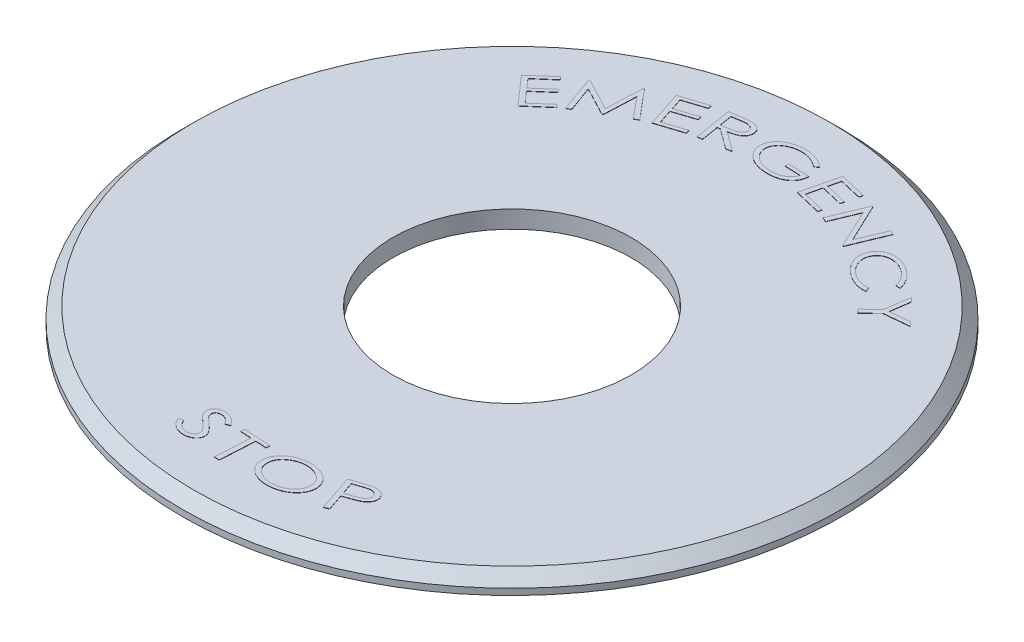
from build123d import *

# Parameters (mm, degrees)
SKETCH1_R         = 29.845
SKETCH1_R_2       = 10.795
EXTRUDE1_DEPTH    = 1.5875
CHAMFER1_SIZE     = 1.016
EXTRUDE3_DEPTH    = 0.508
CIRPATTERN1_COUNT = 8
SKETCH4_R         = 13.208
SKETCH4_R_2       = 11.557
EXTRUDE4_DEPTH    = 0.508
EXTRUDE5_DEPTH    = 0.0254


with BuildPart() as part:
    # Sketch1 → Extrude1 (new body)
    with BuildSketch(Plane(origin=(0, 0, 0), x_dir=(1, 0, 0), z_dir=(0, 1, 0))):
        Circle(SKETCH1_R)
        Circle(SKETCH1_R_2, mode=Mode.SUBTRACT)
    extrude(amount=EXTRUDE1_DEPTH)

    # Chamfer1
    chamfer1_edges = [part.edges().sort_by_distance(p)[0] for p in [
        (-29.845, 1.5875, 0),
    ]]
    chamfer(chamfer1_edges, length=CHAMFER1_SIZE)

    # Sketch3 → Extrude3 (cut)
    with BuildSketch(Plane.XZ):
        with BuildLine():
            ThreePointArc((20.426684812, 20.701966974), (11.156991617, 26.857818732), (0.254, 29.081890809))
            Line((0.254, 29.081890809), (0.254, 13.967690718))
            ThreePointArc((0.254, 13.967690718), (5.441836265, 12.866519267), (9.845405272, 9.911049139))
            Line((9.845405272, 9.911049139), (20.426684812, 20.701966974))
        make_face()
    extrude3 = extrude(amount=-EXTRUDE3_DEPTH, mode=Mode.SUBTRACT)

    # CirPattern1: Extrude3 ×8 about axis
    cirpattern1_axis = Axis((0, 24.887283079, 0), (0, -1, 0))
    for i in range(1, CIRPATTERN1_COUNT):
        add(extrude3.rotate(cirpattern1_axis, i * 360 / CIRPATTERN1_COUNT), mode=Mode.SUBTRACT)

    # Sketch4 → Extrude4 (cut)
    with BuildSketch(Plane.XZ):
        Circle(SKETCH4_R)
        Circle(SKETCH4_R_2, mode=Mode.SUBTRACT)
    extrude(amount=-EXTRUDE4_DEPTH, mode=Mode.SUBTRACT)

    # Sketch5 → Extrude5 (add)
    # profile 1 of 13: a face of its own
    with BuildSketch(Plane(origin=(0, 1.5875, 0), x_dir=(1, 0, 0), z_dir=(0, 1, 0))):
        Polygon((17.415382675, 18.775384539), (17.7626483, 18.409515399), (17.512534368, 16.633224166), (19.286758543, 16.803411883), (19.634713187, 16.436853723), (17.391956026, 16.216367612), (16.210977293, 15.09602256), (15.914699082, 15.408148211), (17.095677814, 16.528493263), align=None)
    # profile 2 of 13: a face of its own
    with BuildSketch(Plane(origin=(0, 1.5875, 0), x_dir=(1, 0, 0), z_dir=(0, 1, 0))):
        with BuildLine():
            Line((16.165389077, 18.955341756), (15.764379962, 18.991859769))
            add(Edge.make_bspline(
                [(15.764379962, 18.991859769), (15.758784608, 19.02523443), (15.74760629, 19.091909851), (15.724069257, 19.190687033), (15.694230038, 19.28757252), (15.659614723, 19.383276421), (15.61989966, 19.477498145), (15.573899237, 19.570187989), (15.523294071, 19.661750633), (15.466312621, 19.751262788), (15.405403506, 19.839428903), (15.338891723, 19.924990889), (15.267821752, 20.008411438), (15.192192321, 20.089817717), (15.111186033, 20.168102084), (15.026551168, 20.245150659), (14.936124459, 20.318545382), (14.873405558, 20.365510973), (14.841783391, 20.389190498)],
                knots=[0, 0, 0, 0, 0.944440671, 1.886790037, 2.831861546, 3.772879647, 4.726674445, 5.684318371, 6.66009623, 7.645493885, 8.644993475, 9.650376926, 10.669121946, 11.703363142, 12.750656649, 13.812855878, 14.897266434, 16, 16, 16, 16], degree=3))
            add(Edge.make_bspline(
                [(14.841783391, 20.389190498), (14.806436211, 20.414142045), (14.736196151, 20.463724451), (14.627147622, 20.530919306), (14.516829407, 20.592366426), (14.405094997, 20.647916687), (14.291237049, 20.695926376), (14.176039294, 20.738013509), (14.059359216, 20.774291962), (13.94136764, 20.802541929), (13.824237549, 20.825778962), (13.708640059, 20.840528478), (13.595765392, 20.850043403), (13.485243586, 20.851459444), (13.377529232, 20.845151454), (13.272540403, 20.832159938), (13.170107929, 20.812037098), (13.070551218, 20.785422071), (12.974589082, 20.751829622), (12.883415726, 20.710692686), (12.796264224, 20.664354668), (12.714774929, 20.609806991), (12.637099332, 20.550058188), (12.564704365, 20.482551154), (12.496133489, 20.40931859), (12.455481047, 20.355578881), (12.435039685, 20.328556817)],
                knots=[0, 0, 0, 0, 1.164710486, 2.31445152, 3.446646924, 4.563933522, 5.672302783, 6.771751945, 7.865184805, 8.960068085, 10.037026936, 11.078661862, 12.096003736, 13.08550605, 14.051799545, 14.999068238, 15.931690709, 16.860224378, 17.771632321, 18.665736224, 19.551136871, 20.425848185, 21.302851695, 22.186825914, 23.088277427, 24, 24, 24, 24], degree=3))
            add(Edge.make_bspline(
                [(12.435039685, 20.328556817), (12.406328165, 20.286520556), (12.349654432, 20.203545084), (12.285502378, 20.068543185), (12.236834456, 19.929645861), (12.207241237, 19.785272083), (12.195833346, 19.636036871), (12.201473374, 19.48208823), (12.225445891, 19.323441294), (12.267167231, 19.161962033), (12.32366417, 19.000287318), (12.396613803, 18.842407973), (12.484472098, 18.689933607), (12.586871401, 18.542508244), (12.704802369, 18.40087282), (12.837502093, 18.264609192), (12.984456959, 18.132799095), (13.091500823, 18.052399865), (13.146107393, 18.011385593)],
                knots=[0, 0, 0, 0, 0.904865988, 1.786117009, 2.650993001, 3.51926302, 4.400912175, 5.309022743, 6.255421567, 7.250865147, 8.273543539, 9.299680296, 10.341662699, 11.401951927, 12.490640397, 13.618110281, 14.784920286, 16, 16, 16, 16], degree=3))
            add(Edge.make_bspline(
                [(13.146107393, 18.011385593), (13.207875787, 17.968480884), (13.329460477, 17.884027406), (13.520973708, 17.77831944), (13.714582925, 17.691146156), (13.911266634, 17.624860087), (14.110494858, 17.577315698), (14.312470068, 17.5509433), (14.517230874, 17.542073769), (14.653724945, 17.553124969), (14.722583087, 17.558700046)],
                knots=[0, 0, 0, 0, 1.074401047, 2.11484725, 3.1214941, 4.105658546, 5.077125838, 6.044240132, 7.013363793, 8, 8, 8, 8], degree=3))
            Line((14.722583087, 17.558700046), (14.883124537, 17.190763848))
            add(Edge.make_bspline(
                [(14.883124537, 17.190763848), (14.844826536, 17.185355668), (14.768234589, 17.174539881), (14.651692546, 17.16881541), (14.534173458, 17.166467648), (14.415062764, 17.173547773), (14.294412637, 17.185260727), (14.172761294, 17.206097358), (14.049280604, 17.23112192), (13.925146133, 17.264325423), (13.800410772, 17.304449505), (13.675609271, 17.350728234), (13.550813079, 17.402935735), (13.426655495, 17.462296316), (13.303311335, 17.528877711), (13.179808597, 17.600999512), (13.057080135, 17.680478066), (12.976644675, 17.737334227), (12.935956568, 17.766094795)],
                knots=[0, 0, 0, 0, 0.890980028, 1.781865701, 2.687119789, 3.598851076, 4.530104735, 5.479550611, 6.441938444, 7.433184799, 8.439302083, 9.460965448, 10.500128348, 11.556129503, 12.631340021, 13.729870093, 14.851659602, 16, 16, 16, 16], degree=3))
            add(Edge.make_bspline(
                [(12.935956568, 17.766094795), (12.897836502, 17.794283925), (12.822680647, 17.84986038), (12.715254276, 17.937174394), (12.612845788, 18.024985616), (12.517460525, 18.115593009), (12.426622239, 18.206543899), (12.341767487, 18.299450063), (12.263486768, 18.39446719), (12.190667526, 18.490826748), (12.1233747, 18.588191156), (12.061530466, 18.687040914), (12.006381123, 18.787949803), (11.957084411, 18.890437508), (11.912325195, 18.994053498), (11.874886641, 19.099659165), (11.841845306, 19.2063804), (11.82526736, 19.278832488), (11.816989554, 19.315009725)],
                knots=[0, 0, 0, 0, 1.163838423, 2.294572891, 3.397925012, 4.474940909, 5.523581547, 6.55339072, 7.562711112, 8.544987084, 9.517863381, 10.467620291, 11.406366228, 12.339489813, 13.259072859, 14.175850973, 15.089154324, 16, 16, 16, 16], degree=3))
            add(Edge.make_bspline(
                [(11.816989554, 19.315009725), (11.805980971, 19.375250146), (11.784412319, 19.493276649), (11.771835369, 19.670179631), (11.778342262, 19.842154539), (11.801058102, 20.009402898), (11.843855529, 20.171558012), (11.904443621, 20.328322973), (11.98106389, 20.481483631), (12.046402961, 20.576173224), (12.07950583, 20.62414601)],
                knots=[0, 0, 0, 0, 1.06650466, 2.089557373, 3.082710036, 4.060709098, 5.024604639, 5.997497307, 6.985467896, 8, 8, 8, 8], degree=3))
            add(Edge.make_bspline(
                [(12.07950583, 20.62414601), (12.098047163, 20.648724563), (12.134926889, 20.697612652), (12.194963355, 20.766244992), (12.257951949, 20.830693494), (12.323737207, 20.8906064), (12.393266379, 20.945302516), (12.465751006, 20.99566534), (12.541498155, 21.042038176), (12.620667783, 21.082990632), (12.702559429, 21.120184332), (12.788010989, 21.151318778), (12.876381621, 21.179268064), (12.968009429, 21.201848287), (13.062827286, 21.219619387), (13.160734062, 21.233563856), (13.261939, 21.242389073), (13.400773491, 21.2477335), (13.576761951, 21.243422674), (13.787903173, 21.21818225), (13.998795817, 21.174803223), (14.208271112, 21.110678989), (14.41752847, 21.028552294), (14.624873094, 20.925456003), (14.832647115, 20.805192758), (14.966011769, 20.711756161), (15.034019719, 20.664109118)],
                knots=[0, 0, 0, 0, 0.674943053, 1.34249872, 1.997802155, 2.650293325, 3.292123821, 3.93618328, 4.584853662, 5.238121838, 5.889601514, 6.55569272, 7.231086586, 7.921228864, 8.623521217, 9.345738311, 10.08896785, 10.850053427, 12.391696234, 13.94344097, 15.507015875, 17.106634685, 18.741425359, 20.430698502, 22.179870954, 24, 24, 24, 24], degree=3))
            add(Edge.make_bspline(
                [(15.034019719, 20.664109118), (15.074687465, 20.633882092), (15.154916093, 20.574250736), (15.26954273, 20.480371688), (15.377215955, 20.383419607), (15.479305814, 20.284597584), (15.574570626, 20.18253668), (15.662660206, 20.077555706), (15.745062313, 19.97065216), (15.820557214, 19.861314278), (15.889751359, 19.75049365), (15.950885155, 19.638311723), (16.004706845, 19.525744532), (16.05190489, 19.412938816), (16.09210977, 19.299693111), (16.123548569, 19.185347262), (16.148898781, 19.070854948), (16.159901478, 18.993781945), (16.165389077, 18.955341756)],
                knots=[0, 0, 0, 0, 1.15394363, 2.276480149, 3.372924232, 4.453076118, 5.511580299, 6.551042735, 7.573224936, 8.584575423, 9.575978905, 10.547434217, 11.492664821, 12.416521926, 13.331390838, 14.227402549, 15.115916379, 16, 16, 16, 16], degree=3))
        make_face()
    # profile 3 of 13: a face of its own
    with BuildSketch(Plane(origin=(0, 1.5875, 0), x_dir=(1, 0, 0), z_dir=(0, 1, 0))):
        Polygon((7.167342293, 20.994868507), (8.479923673, 24.162289297), (8.567429098, 24.126460304), (10.23761139, 20.593170374), (11.242201234, 23.017828577), (11.638387215, 22.853842032), (10.325805834, 19.686421242), (10.235544333, 19.724317292), (8.575697327, 23.216955096), (7.583509827, 20.822613733), align=None)
    # profile 4 of 13: a face of its own
    with BuildSketch(Plane(origin=(0, 1.5875, 0), x_dir=(1, 0, 0), z_dir=(0, 1, 0))):
        Polygon((4.806404428, 25.150815293), (7.238641841, 24.575484347), (7.161471702, 24.247511257), (5.152981034, 24.722245415), (4.907001216, 23.682515597), (6.898266407, 23.211915553), (6.821096268, 22.886009521), (4.829831077, 23.356609564), (4.521839541, 22.052296413), (6.513104732, 21.581696369), (6.435245574, 21.253723279), (4.020233638, 21.824920111), align=None)
    # profile 5 of 13: a face of its own
    with BuildSketch(Plane(origin=(0, 1.5875, 0), x_dir=(1, 0, 0), z_dir=(0, 1, 0))):
        with BuildLine():
            Line((3.0812397, 24.81833546), (2.733285056, 24.580623871))
            add(Edge.make_bspline(
                [(2.733285056, 24.580623871), (2.673436977, 24.628091962), (2.554157143, 24.722697939), (2.361506067, 24.845208713), (2.159524749, 24.950730194), (1.950559352, 25.039940594), (1.737890605, 25.1109867), (1.525702451, 25.16531619), (1.3152429, 25.201433278), (1.175078757, 25.210654261), (1.105821948, 25.21521046)],
                knots=[0, 0, 0, 0, 1.031253619, 2.055333505, 3.078026249, 4.106593243, 5.120984967, 6.103651682, 7.062991215, 8, 8, 8, 8], degree=3))
            add(Edge.make_bspline(
                [(1.105821948, 25.21521046), (1.063101028, 25.216422073), (0.978322966, 25.218826474), (0.851637093, 25.213192007), (0.726299613, 25.203231344), (0.602040162, 25.186791226), (0.479271312, 25.163228627), (0.357799667, 25.133199877), (0.237194534, 25.098672398), (0.119184517, 25.056403004), (0.00503059, 25.009472931), (-0.103784939, 24.957517164), (-0.206450206, 24.901383453), (-0.302568465, 24.839767044), (-0.392174699, 24.773775524), (-0.475336818, 24.702915398), (-0.55274697, 24.628119101), (-0.622622656, 24.548316011), (-0.685447254, 24.465628174), (-0.740604099, 24.380813263), (-0.788243033, 24.294791547), (-0.828281324, 24.207226195), (-0.858865263, 24.117729034), (-0.882447087, 24.027012498), (-0.899005923, 23.934874035), (-0.902818942, 23.872608013), (-0.904735778, 23.84130638)],
                knots=[0, 0, 0, 0, 1.143904827, 2.27003617, 3.39298993, 4.509646056, 5.623997141, 6.738093701, 7.858974671, 8.981187386, 10.092310184, 11.162240194, 12.208060692, 13.222999737, 14.216742081, 15.185201276, 16.146233062, 17.096084502, 18.022171027, 18.924432462, 19.802416207, 20.652812166, 21.498749924, 22.330988109, 23.160974201, 24, 24, 24, 24], degree=3))
            add(Edge.make_bspline(
                [(-0.904735778, 23.84130638), (-0.905015266, 23.809369662), (-0.905573271, 23.745607161), (-0.897267218, 23.650066993), (-0.879808689, 23.555361876), (-0.854097583, 23.46168857), (-0.821076635, 23.368583405), (-0.778550644, 23.276905559), (-0.728289001, 23.185844535), (-0.66952758, 23.096455169), (-0.603956026, 23.009456285), (-0.531154304, 22.926362344), (-0.451948321, 22.847851184), (-0.366063368, 22.774040305), (-0.274130776, 22.704166826), (-0.175637803, 22.638801458), (-0.070355025, 22.578077799), (0.040700855, 22.521862306), (0.156672599, 22.471102047), (0.276197756, 22.426530025), (0.398239205, 22.386636272), (0.524089098, 22.354757994), (0.65254045, 22.327733495), (0.784079894, 22.307099951), (0.918589752, 22.292344805), (1.009555293, 22.287798616), (1.055523554, 22.285501259)],
                knots=[0, 0, 0, 0, 0.830720705, 1.658555833, 2.490822866, 3.333135434, 4.183781145, 5.058235873, 5.959699752, 6.887944834, 7.839371116, 8.792297776, 9.760026476, 10.738837522, 11.736889715, 12.762892491, 13.812537639, 14.897651464, 16.00021756, 17.10467703, 18.215970932, 19.3393317, 20.480936873, 21.630492147, 22.802599822, 24, 24, 24, 24], degree=3))
            add(Edge.make_bspline(
                [(1.055523554, 22.285501259), (1.110651247, 22.284038121), (1.219136115, 22.281158838), (1.378826895, 22.290164925), (1.532611487, 22.306964963), (1.680028407, 22.333684683), (1.821448014, 22.370309779), (1.956539123, 22.41663043), (2.08620268, 22.47149261), (2.207993867, 22.536938128), (2.321483674, 22.60926788), (2.423799537, 22.688726886), (2.514879145, 22.773702083), (2.594059354, 22.865062497), (2.661024702, 22.962870889), (2.7175278, 23.065921093), (2.761447301, 23.175419583), (2.780757609, 23.251706928), (2.790473641, 23.290091102)],
                knots=[0, 0, 0, 0, 1.216415795, 2.39376432, 3.525972574, 4.628388511, 5.696583658, 6.746345628, 7.77714559, 8.799689813, 9.793600061, 10.743482318, 11.654173025, 12.538100203, 13.405454567, 14.264955641, 15.127007943, 16, 16, 16, 16], degree=3))
            Line((2.790473641, 23.290091102), (1.396588007, 23.343145573))
            Line((1.396588007, 23.343145573), (1.40967937, 23.67318572))
            Line((1.40967937, 23.67318572), (3.294146601, 23.600838715))
            add(Edge.make_bspline(
                [(3.294146601, 23.600838715), (3.292233389, 23.568191407), (3.28846477, 23.503883183), (3.27624005, 23.408976772), (3.260563128, 23.316756285), (3.240721201, 23.226959607), (3.21592864, 23.139963118), (3.186103511, 23.055899167), (3.152456049, 22.974296363), (3.113854798, 22.89553633), (3.070092237, 22.8200642), (3.023496765, 22.746228938), (2.970826034, 22.676265847), (2.914035908, 22.608628047), (2.853762969, 22.542857426), (2.787609747, 22.480886384), (2.717773759, 22.420944824), (2.617787536, 22.34551752), (2.484670009, 22.258573254), (2.312051066, 22.170677523), (2.128080492, 22.096206885), (1.931420063, 22.039137147), (1.723509599, 21.995245346), (1.503369232, 21.968699859), (1.271345351, 21.954892005), (1.112725123, 21.95845676), (1.031407885, 21.960284245)],
                knots=[0, 0, 0, 0, 0.749334771, 1.476029413, 2.191716241, 2.892852367, 3.582653236, 4.263579683, 4.9361534, 5.604739593, 6.272019, 6.934944749, 7.604524876, 8.277160389, 8.958818928, 9.647675152, 10.353380785, 11.067187361, 12.517035711, 13.990805936, 15.500060208, 17.059048321, 18.677836377, 20.364969135, 22.136488172, 24, 24, 24, 24], degree=3))
            add(Edge.make_bspline(
                [(1.031407885, 21.960284245), (0.981545644, 21.96267861), (0.883077935, 21.967406991), (0.737602426, 21.980681307), (0.596264153, 21.998566835), (0.458917948, 22.020953195), (0.326020336, 22.049675558), (0.196818795, 22.081575465), (0.072234497, 22.119498507), (-0.04797915, 22.162687081), (-0.16473616, 22.20903061), (-0.277013775, 22.261662497), (-0.385346437, 22.318862838), (-0.489752474, 22.380849202), (-0.589357988, 22.448359114), (-0.684847581, 22.520531415), (-0.777034399, 22.596633854), (-0.834563365, 22.65191529), (-0.863394632, 22.679620182)],
                knots=[0, 0, 0, 0, 1.154471078, 2.279843823, 3.37753283, 4.449062343, 5.497161795, 6.521405501, 7.526291675, 8.507508086, 9.475186834, 10.43053983, 11.373899632, 12.307683914, 13.237349385, 14.155270149, 15.075493585, 16, 16, 16, 16], degree=3))
            add(Edge.make_bspline(
                [(-0.863394632, 22.679620182), (-0.90509801, 22.722990136), (-0.986532604, 22.807679069), (-1.092502645, 22.944500164), (-1.181617722, 23.085191917), (-1.251710772, 23.231030377), (-1.307562042, 23.379876047), (-1.343582737, 23.533841025), (-1.363922307, 23.691918628), (-1.362807193, 23.798529991), (-1.362244458, 23.852330686)],
                knots=[0, 0, 0, 0, 1.098587152, 2.14522189, 3.155756328, 4.135362042, 5.096478688, 6.054172775, 7.018051598, 8, 8, 8, 8], degree=3))
            add(Edge.make_bspline(
                [(-1.362244458, 23.852330686), (-1.359743691, 23.892371601), (-1.354760565, 23.972158663), (-1.334554996, 24.090224753), (-1.307045412, 24.206228628), (-1.267704607, 24.319171879), (-1.219345185, 24.429754112), (-1.161347547, 24.538077791), (-1.093520068, 24.643739354), (-1.01642919, 24.746086541), (-0.931068949, 24.84419605), (-0.839015511, 24.937777442), (-0.738088068, 25.023640942), (-0.631885017, 25.105171995), (-0.51788397, 25.1797845), (-0.39724152, 25.248899304), (-0.26906478, 25.311236711), (-0.134484512, 25.367767561), (0.005522794, 25.41789093), (0.150149758, 25.460752104), (0.299143712, 25.494964305), (0.452005528, 25.522666885), (0.609330384, 25.54255777), (0.770750554, 25.55480374), (0.936313372, 25.559931639), (1.047946452, 25.557046209), (1.10444391, 25.555585894)],
                knots=[0, 0, 0, 0, 0.86760814, 1.728829209, 2.588327547, 3.444946968, 4.312953628, 5.197940884, 6.100998862, 7.027443125, 7.968175818, 8.913571079, 9.865074004, 10.833292346, 11.809273992, 12.811048152, 13.840213923, 14.891606255, 15.96848749, 17.056766544, 18.153873736, 19.275023835, 20.417357277, 21.583817957, 22.777171225, 24, 24, 24, 24], degree=3))
            add(Edge.make_bspline(
                [(1.10444391, 25.555585894), (1.150398271, 25.553386562), (1.241737641, 25.549015148), (1.377407384, 25.536732905), (1.510585916, 25.518357281), (1.64167861, 25.496634763), (1.770587141, 25.469583038), (1.897432897, 25.438310202), (2.021487384, 25.400509557), (2.14401053, 25.359416978), (2.264986763, 25.312378703), (2.384690467, 25.259328012), (2.503372678, 25.200420263), (2.621579725, 25.136719859), (2.73780529, 25.065202774), (2.853595873, 24.988655352), (2.969004456, 24.907017733), (3.043601654, 24.848075026), (3.0812397, 24.81833546)],
                knots=[0, 0, 0, 0, 1.027605681, 2.042479838, 3.041567088, 4.030047356, 5.010050691, 5.983073261, 6.947182792, 7.905995316, 8.869189879, 9.845358624, 10.829636292, 11.82826242, 12.843616242, 13.876637537, 14.928656631, 16, 16, 16, 16], degree=3))
        make_face()
    # profile 6 of 13: a face of its own
    with BuildSketch(Plane(origin=(0, 1.5875, 0), x_dir=(1, 0, 0), z_dir=(0, 1, 0))):
        with BuildLine():
            Line((-5.441025322, 25.032222792), (-4.583196546, 25.174160726))
            add(Edge.make_bspline(
                [(-4.583196546, 25.174160726), (-4.525788015, 25.183406764), (-4.415850739, 25.201112917), (-4.257915067, 25.225591374), (-4.114061129, 25.245322973), (-3.984584066, 25.262173775), (-3.869279805, 25.274842053), (-3.768168068, 25.282967188), (-3.681100154, 25.28836085), (-3.627762941, 25.288955447), (-3.603411389, 25.289226915)],
                knots=[0, 0, 0, 0, 1.413389132, 2.706638712, 3.884570293, 4.942607394, 5.880293255, 6.703658086, 7.408144226, 8, 8, 8, 8], degree=3))
            add(Edge.make_bspline(
                [(-3.603411389, 25.289226915), (-3.570996762, 25.2883304), (-3.507384099, 25.286571019), (-3.413973201, 25.275757587), (-3.324184528, 25.260092166), (-3.237836456, 25.238701993), (-3.15510526, 25.21193563), (-3.075968517, 25.179467396), (-3.000880265, 25.140863929), (-2.930071108, 25.096658736), (-2.863758743, 25.048551371), (-2.805165052, 24.993994806), (-2.752019228, 24.936419167), (-2.707491951, 24.872887708), (-2.668152756, 24.806028728), (-2.637392819, 24.733640063), (-2.612916853, 24.657054454), (-2.602648475, 24.603783724), (-2.597443507, 24.576781168)],
                knots=[0, 0, 0, 0, 1.156614166, 2.269818095, 3.351782019, 4.407255621, 5.441353664, 6.451931474, 7.45624228, 8.450065317, 9.428632439, 10.374105715, 11.302481322, 12.218988261, 13.136923152, 14.06562427, 15.019478656, 16, 16, 16, 16], degree=3))
            add(Edge.make_bspline(
                [(-2.597443507, 24.576781168), (-2.593987615, 24.554088033), (-2.587137031, 24.509103645), (-2.585193826, 24.441511396), (-2.586489472, 24.375093677), (-2.595435111, 24.310217335), (-2.607919172, 24.24634733), (-2.628016737, 24.18423514), (-2.651623427, 24.122526388), (-2.682293403, 24.062915601), (-2.717460593, 24.004846158), (-2.757439312, 23.949021648), (-2.802365804, 23.895570119), (-2.853086657, 23.845396233), (-2.908322571, 23.797083486), (-2.968267117, 23.750893629), (-3.033327328, 23.707255905), (-3.104163848, 23.666647002), (-3.180931335, 23.627579369), (-3.265731546, 23.592109254), (-3.357827317, 23.557628687), (-3.457908677, 23.525492392), (-3.565571958, 23.494867909), (-3.681446206, 23.468025727), (-3.804901288, 23.441350254), (-3.890216979, 23.426292393), (-3.934140556, 23.418540066)],
                knots=[0, 0, 0, 0, 0.831095859, 1.64747345, 2.446915019, 3.23566926, 4.017586693, 4.802113548, 5.598124673, 6.409607998, 7.227554039, 8.056772184, 8.895502071, 9.754795315, 10.639590521, 11.553579962, 12.495455095, 13.476246115, 14.511069282, 15.614923617, 16.80538112, 18.074100377, 19.423218906, 20.860648177, 22.383749133, 24, 24, 24, 24], degree=3))
            Line((-3.934140556, 23.418540066), (-2.124776407, 22.099068495))
            Line((-2.124776407, 22.099068495), (-2.657388169, 22.01087405))
            Line((-2.657388169, 22.01087405), (-4.463996242, 23.330345621))
            Line((-4.463996242, 23.330345621), (-4.709976059, 23.289693495))
            Line((-4.709976059, 23.289693495), (-4.449526841, 21.713906819))
            Line((-4.449526841, 21.713906819), (-4.880163776, 21.642937852))
            Line((-4.880163776, 21.642937852), (-5.441025322, 25.032222792))
        make_face()
        with BuildLine():
            Line((-4.955266858, 24.771084554), (-4.764408568, 23.619044623))
            Line((-4.764408568, 23.619044623), (-4.023024019, 23.737555908))
            add(Edge.make_bspline(
                [(-4.023024019, 23.737555908), (-3.988329602, 23.743680417), (-3.921386898, 23.755497627), (-3.824541781, 23.773874406), (-3.735077659, 23.793581136), (-3.653261777, 23.815296222), (-3.578309754, 23.836218915), (-3.511014866, 23.8589705), (-3.450879923, 23.88216633), (-3.381835816, 23.913926859), (-3.305413234, 23.957589094), (-3.226335106, 24.019329748), (-3.15931844, 24.088112025), (-3.107185625, 24.164907692), (-3.068094013, 24.246149745), (-3.044418859, 24.33051044), (-3.035210358, 24.416976141), (-3.041915589, 24.474148405), (-3.045305921, 24.503056125)],
                knots=[0, 0, 0, 0, 1.214221145, 2.342833593, 3.397161922, 4.370562153, 5.259973204, 6.078506992, 6.817890136, 7.480208607, 8.69669817, 9.841516373, 10.927606473, 11.992460607, 13.026355384, 14.021243257, 14.999491336, 16, 16, 16, 16], degree=3))
            add(Edge.make_bspline(
                [(-3.045305921, 24.503056125), (-3.051393529, 24.530716681), (-3.063483408, 24.585650038), (-3.100073505, 24.662484417), (-3.149459133, 24.733308805), (-3.213528284, 24.795149346), (-3.286580795, 24.8496433), (-3.368936026, 24.892774508), (-3.458904059, 24.923590487), (-3.539634336, 24.940518263), (-3.610646878, 24.947468936), (-3.672284196, 24.950221864), (-3.74149965, 24.949275836), (-3.818265879, 24.945049473), (-3.902307387, 24.937106046), (-3.994019358, 24.926959944), (-4.093194097, 24.912897659), (-4.161761584, 24.902093192), (-4.197345851, 24.896486029)],
                knots=[0, 0, 0, 0, 0.993102715, 1.972283745, 2.969319037, 4.014357147, 5.088478793, 6.164965882, 7.268320668, 8.422944777, 9.056167486, 9.775645857, 10.591349143, 11.489079841, 12.478333242, 13.55923404, 14.73332286, 16, 16, 16, 16], degree=3))
            Line((-4.197345851, 24.896486029), (-4.955266858, 24.771084554))
        make_face(mode=Mode.SUBTRACT)
    # profile 7 of 13: a face of its own
    with BuildSketch(Plane(origin=(0, 1.5875, 0), x_dir=(1, 0, 0), z_dir=(0, 1, 0))):
        Polygon((-9.075138773, 23.95318508), (-6.697333868, 24.725575488), (-6.592602965, 24.40380357), (-8.555618373, 23.766460905), (-8.224200188, 22.746023622), (-6.278410257, 23.377854134), (-6.174368373, 23.058838292), (-8.120158304, 22.42700778), (-7.704679788, 21.147499317), (-5.758889858, 21.779329829), (-5.654158955, 21.45755791), (-8.014738382, 20.690679655), align=None)
    # profile 8 of 13: a face of its own
    with BuildSketch(Plane(origin=(0, 1.5875, 0), x_dir=(1, 0, 0), z_dir=(0, 1, 0))):
        Polygon((-13.082683134, 17.918189756), (-14.247814427, 21.20481085), (-14.185802709, 21.239950824), (-11.241624106, 19.682767664), (-11.111399497, 23.001772656), (-11.049387778, 23.03691263), (-8.798362387, 20.372475781), (-9.173188776, 20.157501822), (-10.764822891, 22.073663932), (-10.888846328, 19.17496059), (-10.984619983, 19.119839062), (-13.574642769, 20.485474913), (-12.715435955, 18.128340581), align=None)
    # profile 9 of 13: a face of its own
    with BuildSketch(Plane(origin=(0, 1.5875, 0), x_dir=(1, 0, 0), z_dir=(0, 1, 0))):
        Polygon((-17.667708218, 18.522848262), (-15.779795891, 20.175805077), (-15.558620761, 19.922935068), (-17.117181959, 18.558677255), (-16.415071499, 17.756659026), (-14.870290683, 19.109203514), (-14.650493591, 18.858400563), (-16.195274407, 17.505856075), (-15.314018981, 16.499199174), (-13.769238165, 17.851743662), (-13.548063035, 17.598873653), (-15.42219498, 15.957630163), align=None)
    # profile 10 of 13: a face of its own
    with BuildSketch(Plane(origin=(0, 1.5875, 0), x_dir=(1, 0, 0), z_dir=(0, 1, 0))):
        with BuildLine():
            Line((-6.302384442, -23.930919763), (-5.897837167, -23.831360468))
            add(Edge.make_bspline(
                [(-5.897837167, -23.831360468), (-5.874448848, -23.882540777), (-5.829274033, -23.981396153), (-5.748663754, -24.117550234), (-5.661495552, -24.237709126), (-5.565479606, -24.340220633), (-5.462535954, -24.426163241), (-5.351990877, -24.494947779), (-5.234030202, -24.547450403), (-5.150832879, -24.567827614), (-5.109075147, -24.57805518)],
                knots=[0, 0, 0, 0, 1.192859355, 2.304022002, 3.350025584, 4.335499584, 5.275488934, 6.186106292, 7.089585054, 8, 8, 8, 8], degree=3))
            add(Edge.make_bspline(
                [(-5.109075147, -24.57805518), (-5.07294759, -24.584482822), (-5.001530451, -24.59718902), (-4.893378671, -24.601822927), (-4.78672178, -24.598430669), (-4.682746432, -24.582539966), (-4.584091573, -24.558488244), (-4.494466449, -24.523149141), (-4.414674845, -24.479564765), (-4.345682558, -24.426972753), (-4.288368024, -24.367009177), (-4.240815745, -24.303200534), (-4.207267863, -24.233193197), (-4.194286725, -24.18404221), (-4.187801109, -24.159485468)],
                knots=[0, 0, 0, 0, 1.180098629, 2.33282499, 3.477345561, 4.610557959, 5.712748766, 6.739668966, 7.702843305, 8.631334134, 9.519948772, 10.365741444, 11.183494221, 12, 12, 12, 12], degree=3))
            add(Edge.make_bspline(
                [(-4.187801109, -24.159485468), (-4.183948241, -24.130296576), (-4.176107834, -24.070898531), (-4.188602708, -23.978655859), (-4.21743423, -23.883819783), (-4.249985143, -23.823617725), (-4.267027872, -23.792097648)],
                knots=[0, 0, 0, 0, 0.916811314, 1.865668582, 2.882525039, 4, 4, 4, 4], degree=3))
            add(Edge.make_bspline(
                [(-4.267027872, -23.792097648), (-4.281689284, -23.768759965), (-4.312718457, -23.71936848), (-4.368276538, -23.645255615), (-4.432679008, -23.565395384), (-4.507214819, -23.480410067), (-4.592262826, -23.391234021), (-4.686270473, -23.296113982), (-4.791047623, -23.196825432), (-4.864744306, -23.129420919), (-4.90294534, -23.094481462)],
                knots=[0, 0, 0, 0, 0.698300792, 1.477872284, 2.345626764, 3.298508425, 4.341877357, 5.468613663, 6.687843581, 8, 8, 8, 8], degree=3))
            add(Edge.make_bspline(
                [(-4.90294534, -23.094481462), (-4.940907947, -23.060003225), (-5.013508958, -22.994065847), (-5.115588285, -22.898173372), (-5.206470279, -22.810706978), (-5.284844395, -22.730597845), (-5.35239884, -22.659475451), (-5.40788291, -22.596396407), (-5.452312672, -22.541848988), (-5.475749881, -22.506634943), (-5.486278673, -22.490815596)],
                knots=[0, 0, 0, 0, 1.463069644, 2.798025231, 3.995726303, 5.06130694, 5.9952607, 6.793743548, 7.458108568, 8, 8, 8, 8], degree=3))
            add(Edge.make_bspline(
                [(-5.486278673, -22.490815596), (-5.500414726, -22.466937745), (-5.528026824, -22.420296891), (-5.562759692, -22.348497176), (-5.589280842, -22.276774122), (-5.609423501, -22.205603794), (-5.621503063, -22.134368366), (-5.625401345, -22.063185915), (-5.623271384, -21.992118768), (-5.615143226, -21.945513176), (-5.611078352, -21.922205821)],
                knots=[0, 0, 0, 0, 1.115463026, 2.178845442, 3.201719598, 4.18663678, 5.14910728, 6.099900409, 7.049764303, 8, 8, 8, 8], degree=3))
            add(Edge.make_bspline(
                [(-5.611078352, -21.922205821), (-5.602346368, -21.88599329), (-5.585037269, -21.814210488), (-5.535834317, -21.714699947), (-5.474287549, -21.621821383), (-5.394424116, -21.540167488), (-5.302255277, -21.467551977), (-5.196082844, -21.408750516), (-5.078984129, -21.361243014), (-4.951011499, -21.328912456), (-4.816306958, -21.307350298), (-4.677398654, -21.30172833), (-4.535619294, -21.30870477), (-4.44171155, -21.325446418), (-4.393930917, -21.333964635)],
                knots=[0, 0, 0, 0, 0.890362424, 1.764933495, 2.644407371, 3.551791802, 4.489790276, 5.448047803, 6.450924365, 7.510828029, 8.605058798, 9.715462043, 10.837617997, 12, 12, 12, 12], degree=3))
            add(Edge.make_bspline(
                [(-4.393930917, -21.333964635), (-4.343603972, -21.345484057), (-4.244222481, -21.36823166), (-4.101759885, -21.421257176), (-3.967073372, -21.487012354), (-3.861763848, -21.554586988), (-3.780118326, -21.615747828), (-3.720039297, -21.669602552), (-3.659679375, -21.729277326), (-3.599446261, -21.795184034), (-3.53961325, -21.867604458), (-3.481066907, -21.947144968), (-3.421996003, -22.032637581), (-3.384099852, -22.09267049), (-3.364684122, -22.123427776)],
                knots=[0, 0, 0, 0, 1.385695625, 2.736357186, 4.072892509, 5.405292411, 6.090905435, 6.811474688, 7.570643579, 8.370543921, 9.208988278, 10.092996824, 11.022965192, 12, 12, 12, 12], degree=3))
            Line((-3.364684122, -22.123427776), (-3.762220179, -22.262951013))
            add(Edge.make_bspline(
                [(-3.762220179, -22.262951013), (-3.777932918, -22.238293938), (-3.808350084, -22.190562072), (-3.855328648, -22.123342985), (-3.901395508, -22.062229471), (-3.944671625, -22.005849309), (-3.988909732, -21.956837666), (-4.030441361, -21.912561001), (-4.071104625, -21.874203607), (-4.124674863, -21.832385236), (-4.193287444, -21.787360917), (-4.280980987, -21.742988227), (-4.374422206, -21.707297743), (-4.439984831, -21.692176471), (-4.473157679, -21.684525532)],
                knots=[0, 0, 0, 0, 1.111677637, 2.152017151, 3.117103419, 4.022010551, 4.852990699, 5.626124796, 6.330356213, 6.975721552, 8.208110513, 9.444114697, 10.706793757, 12, 12, 12, 12], degree=3))
            add(Edge.make_bspline(
                [(-4.473157679, -21.684525532), (-4.515564816, -21.677377047), (-4.596984365, -21.663652318), (-4.716955023, -21.664688859), (-4.828431772, -21.682111079), (-4.913522604, -21.713589353), (-4.974789358, -21.746450304), (-5.015737476, -21.77383403), (-5.051862625, -21.804045615), (-5.082855471, -21.837458646), (-5.109980623, -21.872991371), (-5.130939985, -21.91250004), (-5.148221112, -21.954158163), (-5.154836388, -21.983775993), (-5.158153673, -21.998628096)],
                knots=[0, 0, 0, 0, 1.844797359, 3.54191724, 5.130070549, 6.670946088, 7.412284434, 8.114144443, 8.784026306, 9.430544098, 10.06921551, 10.698342105, 11.347273011, 12, 12, 12, 12], degree=3))
            add(Edge.make_bspline(
                [(-5.158153673, -21.998628096), (-5.161260466, -22.017270133), (-5.167483567, -22.054611295), (-5.167139183, -22.111811548), (-5.158938124, -22.16936443), (-5.144400076, -22.228570842), (-5.11889664, -22.290529246), (-5.0806977, -22.355354923), (-5.032226637, -22.425886186), (-4.993566506, -22.472432911), (-4.973057519, -22.497125692)],
                knots=[0, 0, 0, 0, 0.820058646, 1.642628578, 2.472748903, 3.342189268, 4.285091436, 5.372123165, 6.605925823, 8, 8, 8, 8], degree=3))
            add(Edge.make_bspline(
                [(-4.973057519, -22.497125692), (-4.965159999, -22.505586206), (-4.946210459, -22.525886606), (-4.911582677, -22.559989497), (-4.8668978, -22.603675423), (-4.810178911, -22.65536521), (-4.743452491, -22.716974891), (-4.66502716, -22.787152666), (-4.576519664, -22.866949366), (-4.513405214, -22.922762383), (-4.480168897, -22.952153737)],
                knots=[0, 0, 0, 0, 0.413926526, 0.993187278, 1.738044919, 2.649002429, 3.737621529, 4.986499053, 6.413078599, 8, 8, 8, 8], degree=3))
            add(Edge.make_bspline(
                [(-4.480168897, -22.952153737), (-4.440272802, -22.987962719), (-4.362975949, -23.057340976), (-4.253822619, -23.160703044), (-4.155333735, -23.25978414), (-4.067320207, -23.354034573), (-3.991074672, -23.44491986), (-3.923759472, -23.529954525), (-3.868275211, -23.611419378), (-3.822659741, -23.688753562), (-3.785564167, -23.763248919), (-3.756185195, -23.83628674), (-3.732881293, -23.90794712), (-3.715661652, -23.978186856), (-3.705881911, -24.047254006), (-3.702387365, -24.115037951), (-3.704566844, -24.181858496), (-3.712166923, -24.225449577), (-3.715946141, -24.247125692)],
                knots=[0, 0, 0, 0, 1.637718689, 3.173004737, 4.591652125, 5.905241803, 7.111028195, 8.215007918, 9.217037246, 10.119497343, 10.956062636, 11.756856453, 12.522271673, 13.256516866, 13.9633118, 14.649652694, 15.328525833, 16, 16, 16, 16], degree=3))
            add(Edge.make_bspline(
                [(-3.715946141, -24.247125692), (-3.723018492, -24.277545732), (-3.737031626, -24.337819905), (-3.773275257, -24.422932871), (-3.818252816, -24.503392722), (-3.87512619, -24.577914326), (-3.942065422, -24.647627782), (-4.019906092, -24.711893147), (-4.108867752, -24.769552465), (-4.206149785, -24.822602499), (-4.310319944, -24.867724468), (-4.419021726, -24.903548781), (-4.530830505, -24.930515661), (-4.646090676, -24.946938391), (-4.764243365, -24.954969313), (-4.885406996, -24.952266052), (-5.009726024, -24.941645714), (-5.092812391, -24.926495846), (-5.135016654, -24.918800372)],
                knots=[0, 0, 0, 0, 0.862889881, 1.709727327, 2.549719325, 3.408697286, 4.296182248, 5.219592561, 6.195516123, 7.225886962, 8.28329068, 9.332591872, 10.389995589, 11.462075394, 12.551056154, 13.663752016, 14.813287593, 16, 16, 16, 16], degree=3))
            add(Edge.make_bspline(
                [(-5.135016654, -24.918800372), (-5.167602513, -24.91172468), (-5.232071531, -24.897725881), (-5.32600052, -24.869927291), (-5.416924925, -24.838456704), (-5.504408226, -24.802240641), (-5.588358463, -24.76052264), (-5.668879988, -24.714021084), (-5.746917598, -24.664008521), (-5.820901387, -24.607906118), (-5.892377838, -24.547076345), (-5.959410337, -24.478226797), (-6.02507257, -24.404215076), (-6.08660017, -24.322278387), (-6.145561156, -24.234142969), (-6.200554755, -24.138831077), (-6.254566127, -24.038091676), (-6.28623055, -23.967124375), (-6.302384442, -23.930919763)],
                knots=[0, 0, 0, 0, 1.00096488, 1.980344416, 2.939117036, 3.889195292, 4.821298284, 5.751788433, 6.68026522, 7.602381865, 8.537860141, 9.495579208, 10.485163495, 11.506944731, 12.569645414, 13.667314615, 14.809959391, 16, 16, 16, 16], degree=3))
        make_face()
    # profile 11 of 13: a face of its own
    with BuildSketch(Plane(origin=(0, 1.5875, 0), x_dir=(1, 0, 0), z_dir=(0, 1, 0))):
        Polygon((-2.453061846, -22.116195311), (-2.434131557, -21.777553484), (0.006473411, -21.913571112), (-0.012456878, -22.252212939), (-1.004544218, -22.196824317), (-1.180525788, -25.339252202), (-1.634151589, -25.314011817), (-1.458170019, -22.171583933), align=None)
    # profile 12 of 13: a face of its own
    with BuildSketch(Plane(origin=(0, 1.5875, 0), x_dir=(1, 0, 0), z_dir=(0, 1, 0))):
        with BuildLine():
            add(Edge.make_bspline(
                [(2.818786168, -21.489478476), (2.900944095, -21.479535052), (3.062065601, -21.460034811), (3.301436312, -21.45333521), (3.53279562, -21.461519081), (3.75638742, -21.488779302), (3.971919452, -21.534558752), (4.179563502, -21.597814317), (4.379388171, -21.678478721), (4.538141791, -21.760673948), (4.659561942, -21.833004965), (4.745344262, -21.891041366), (4.82679189, -21.950786495), (4.902428926, -22.01452037), (4.97426902, -22.079268903), (5.040380056, -22.147383681), (5.100494866, -22.218702507), (5.15720449, -22.291610732), (5.208195269, -22.367806414), (5.253572641, -22.446869138), (5.295735142, -22.527525184), (5.330955774, -22.611754127), (5.3620464, -22.698286707), (5.388160129, -22.787414232), (5.408248653, -22.879362678), (5.418362992, -22.94168485), (5.423453636, -22.973052194)],
                knots=[0, 0, 0, 0, 1.787855565, 3.506198258, 5.169374849, 6.787725367, 8.367912482, 9.925853553, 11.473574089, 13.018844517, 13.78464652, 14.527171344, 15.256591147, 15.966726467, 16.663971414, 17.346271813, 18.016346186, 18.679126833, 19.341791976, 19.995911744, 20.648801614, 21.307430729, 21.96729838, 22.635485188, 23.313226674, 24, 24, 24, 24], degree=3))
            add(Edge.make_bspline(
                [(5.423453636, -22.973052194), (5.427349498, -23.004331826), (5.435093466, -23.066507659), (5.439735726, -23.159729345), (5.439138469, -23.25197012), (5.432838839, -23.343062974), (5.420904997, -23.433223213), (5.4032006, -23.522109968), (5.380927022, -23.610013941), (5.352657125, -23.696934287), (5.318349022, -23.782482705), (5.278905387, -23.867284996), (5.233683958, -23.950541384), (5.184276155, -24.033727382), (5.127752635, -24.114628607), (5.066678142, -24.195242308), (4.999087362, -24.273987517), (4.903340184, -24.378596449), (4.773807146, -24.50161886), (4.605661979, -24.634466117), (4.426062306, -24.752277921), (4.23448885, -24.853829886), (4.03200091, -24.94114289), (3.817829739, -25.012557439), (3.592069818, -25.069172646), (3.436467774, -25.093950779), (3.357247706, -25.106565815)],
                knots=[0, 0, 0, 0, 0.688404479, 1.368370372, 2.037205004, 2.702503336, 3.361740495, 4.022577051, 4.681339568, 5.341682896, 6.017650312, 6.6937334, 7.383575208, 8.086665704, 8.806082687, 9.53823116, 10.295234924, 11.072087195, 12.635766893, 14.191399536, 15.747635266, 17.321317991, 18.922186784, 20.559280734, 22.248261991, 24, 24, 24, 24], degree=3))
            add(Edge.make_bspline(
                [(3.357247706, -25.106565815), (3.276722433, -25.116172419), (3.118618305, -25.135034121), (2.883447264, -25.142508469), (2.655596224, -25.13214578), (2.434875814, -25.104311064), (2.221427452, -25.058568501), (2.015022554, -24.99548022), (1.816153094, -24.913756665), (1.657295981, -24.831507822), (1.536310548, -24.758028389), (1.450250641, -24.700189703), (1.369166142, -24.640231475), (1.292997269, -24.577628391), (1.222294916, -24.51233885), (1.156017825, -24.444963915), (1.095105443, -24.374986023), (1.039368947, -24.302399535), (0.989006823, -24.227339456), (0.943101183, -24.14998552), (0.902571671, -24.070027958), (0.866612541, -23.987679749), (0.835678409, -23.90298308), (0.810549206, -23.815529725), (0.789995668, -23.725890818), (0.780495799, -23.664892759), (0.775717257, -23.634210046)],
                knots=[0, 0, 0, 0, 1.770411716, 3.47604408, 5.131484262, 6.747065312, 8.328736006, 9.893142606, 11.454181947, 13.01788902, 13.794305276, 14.544563638, 15.281580487, 15.995855317, 16.696599072, 17.382349711, 18.058864165, 18.721391057, 19.379638002, 20.031761957, 20.684584598, 21.336009116, 21.993147034, 22.652165235, 23.322023891, 24, 24, 24, 24], degree=3))
            add(Edge.make_bspline(
                [(0.775717257, -23.634210046), (0.77075771, -23.593134841), (0.760891664, -23.51142378), (0.759503026, -23.388217563), (0.767041975, -23.265851854), (0.78465095, -23.144390614), (0.812041166, -23.024094626), (0.849752023, -22.904939227), (0.89641788, -22.786291565), (0.954292449, -22.669814276), (1.019861703, -22.555460642), (1.094188487, -22.445781308), (1.175987537, -22.340453968), (1.265856603, -22.240574182), (1.362833623, -22.14456127), (1.468317303, -22.054292437), (1.581392908, -21.968591239), (1.701744894, -21.888472743), (1.827509269, -21.813573132), (1.957794611, -21.74546592), (2.09243477, -21.685286503), (2.230246739, -21.630997556), (2.3722554, -21.58490238), (2.51757557, -21.545668402), (2.666580074, -21.512958444), (2.767741286, -21.497352879), (2.818786168, -21.489478476)],
                knots=[0, 0, 0, 0, 0.906250732, 1.802808042, 2.695890509, 3.591276384, 4.489704812, 5.396968358, 6.328209026, 7.281215439, 8.245063329, 9.215422862, 10.182694831, 11.165788158, 12.158271751, 13.171698026, 14.206441969, 15.266290356, 16.338935444, 17.413486894, 18.486474399, 19.569938396, 20.658500392, 21.756960519, 22.868185928, 24, 24, 24, 24], degree=3))
        make_face()
        with BuildLine():
            add(Edge.make_bspline(
                [(2.88609386, -21.823913572), (2.845585014, -21.830267142), (2.765124079, -21.84288696), (2.646534843, -21.869182006), (2.53034834, -21.900599976), (2.416622556, -21.938620945), (2.305101334, -21.982625867), (2.196302757, -22.033521926), (2.089711208, -22.089446464), (1.986268982, -22.150999221), (1.887328729, -22.216989894), (1.794247476, -22.287311325), (1.708279696, -22.36153406), (1.628545046, -22.438919677), (1.555539692, -22.519759049), (1.488379048, -22.603868462), (1.429199283, -22.69250501), (1.375670678, -22.783271758), (1.329910981, -22.876792702), (1.292342691, -22.972069869), (1.261344383, -23.068339462), (1.24102689, -23.166448518), (1.226305127, -23.265446773), (1.221237624, -23.366077441), (1.222681161, -23.468113595), (1.230836375, -23.536098367), (1.234952033, -23.570407963)],
                knots=[0, 0, 0, 0, 1.107330178, 2.19944109, 3.279074518, 4.357045693, 5.436679121, 6.515555618, 7.599866553, 8.686820362, 9.765327431, 10.810718506, 11.835726555, 12.8312295, 13.810019789, 14.776188987, 15.735653194, 16.686250572, 17.620739621, 18.544463148, 19.450898125, 20.348563973, 21.247560617, 22.151684575, 23.067218249, 24, 24, 24, 24], degree=3))
            add(Edge.make_bspline(
                [(1.234952033, -23.570407963), (1.243521605, -23.620478481), (1.260429728, -23.719269699), (1.30727022, -23.861295328), (1.368733194, -23.995346732), (1.447830642, -24.12044128), (1.542021249, -24.237784986), (1.654288192, -24.344918126), (1.781122341, -24.445326338), (1.923335774, -24.534912557), (2.075322648, -24.614488624), (2.234908007, -24.679687264), (2.399109532, -24.732089582), (2.56887341, -24.768937148), (2.743554537, -24.792521033), (2.923411618, -24.799981792), (3.108435078, -24.79612012), (3.232531148, -24.781140061), (3.295548988, -24.773532963)],
                knots=[0, 0, 0, 0, 0.920023441, 1.815244585, 2.702587397, 3.587964884, 4.492029166, 5.424076272, 6.395660719, 7.420778264, 8.467058793, 9.502712181, 10.542752062, 11.588457431, 12.648685345, 13.734743105, 14.849668671, 16, 16, 16, 16], degree=3))
            add(Edge.make_bspline(
                [(3.295548988, -24.773532963), (3.337938466, -24.767252096), (3.421965192, -24.75480182), (3.545610452, -24.727527978), (3.66617788, -24.695525471), (3.783447827, -24.657644122), (3.897335253, -24.613927527), (4.008320019, -24.565135502), (4.115556444, -24.509470301), (4.219103331, -24.448772831), (4.31754413, -24.383070534), (4.410303069, -24.313633531), (4.496649679, -24.240800586), (4.576425485, -24.164305584), (4.648347521, -24.083339023), (4.71490422, -23.999672589), (4.774534629, -23.912079629), (4.826800956, -23.820933907), (4.872928714, -23.727840954), (4.909709056, -23.632366344), (4.939550633, -23.535902732), (4.961149812, -23.43834672), (4.975645853, -23.339468785), (4.980739483, -23.239318724), (4.979293977, -23.137743555), (4.971139144, -23.07022846), (4.967023347, -23.036153155)],
                knots=[0, 0, 0, 0, 1.151065934, 2.281705404, 3.399719472, 4.501837848, 5.591054564, 6.676209188, 7.757468813, 8.835496237, 9.899607822, 10.935707602, 11.947157732, 12.933042369, 13.902471587, 14.854726517, 15.803933095, 16.746365123, 17.675927346, 18.592482084, 19.492277633, 20.386556621, 21.274596839, 22.173954063, 23.078382808, 24, 24, 24, 24], degree=3))
            add(Edge.make_bspline(
                [(4.967023347, -23.036153155), (4.961500969, -23.002385955), (4.950596228, -22.935707691), (4.924686487, -22.838312036), (4.89269897, -22.744123565), (4.852829271, -22.653407563), (4.8042929, -22.567103584), (4.750836306, -22.483130605), (4.688278479, -22.403639042), (4.619129894, -22.327526721), (4.543699251, -22.255563045), (4.46227174, -22.188501393), (4.375601022, -22.126065704), (4.282579991, -22.069307921), (4.184198928, -22.017416973), (4.080381211, -21.970219013), (3.970475313, -21.929253688), (3.856186942, -21.892134624), (3.738536238, -21.860655225), (3.619080392, -21.83626051), (3.499038371, -21.817950762), (3.378044132, -21.805986899), (3.25611547, -21.80045743), (3.133243436, -21.801009192), (3.009649983, -21.808678043), (2.927417108, -21.818818061), (2.88609386, -21.823913572)],
                knots=[0, 0, 0, 0, 0.922193316, 1.821005244, 2.713876161, 3.60268987, 4.488437267, 5.381708444, 6.28433466, 7.212324076, 8.152875859, 9.092941892, 10.054871633, 11.03090174, 12.028883224, 13.052736517, 14.103847317, 15.190043147, 16.292228651, 17.386076408, 18.476141353, 19.565404405, 20.663148579, 21.76605456, 22.877409028, 24, 24, 24, 24], degree=3))
        make_face(mode=Mode.SUBTRACT)
    # profile 13 of 13: a face of its own
    with BuildSketch(Plane(origin=(0, 1.5875, 0), x_dir=(1, 0, 0), z_dir=(0, 1, 0))):
        with BuildLine():
            Line((6.12775422, -21.031635031), (6.968399252, -20.747680704))
            add(Edge.make_bspline(
                [(6.968399252, -20.747680704), (7.026309837, -20.72813544), (7.137022123, -20.690769199), (7.296692773, -20.639460646), (7.442094982, -20.594658699), (7.573220114, -20.556132282), (7.689850344, -20.523140318), (7.792645402, -20.498352634), (7.881040897, -20.478350051), (7.935662336, -20.470223984), (7.960486592, -20.466530864)],
                knots=[0, 0, 0, 0, 1.420990453, 2.716620833, 3.899093688, 4.958208013, 5.894171148, 6.716509379, 7.416681433, 8, 8, 8, 8], degree=3))
            add(Edge.make_bspline(
                [(7.960486592, -20.466530864), (7.992230667, -20.462573805), (8.054631079, -20.45479528), (8.147418144, -20.451038699), (8.237355536, -20.452027289), (8.324785043, -20.459772684), (8.409566769, -20.473869287), (8.491817919, -20.493493978), (8.571614445, -20.51875335), (8.648254785, -20.550221197), (8.721294249, -20.586800614), (8.788185922, -20.630503342), (8.848833794, -20.68028461), (8.904821086, -20.734569989), (8.953290679, -20.796552383), (8.996126866, -20.86389045), (9.032859, -20.937279691), (9.052142066, -20.989136306), (9.061948932, -21.015509229)],
                knots=[0, 0, 0, 0, 1.142993882, 2.246822131, 3.316227504, 4.356155335, 5.380668963, 6.385651848, 7.37636802, 8.369195096, 9.344291691, 10.291950022, 11.218270599, 12.145682892, 13.073283283, 14.023442035, 14.994774111, 16, 16, 16, 16], degree=3))
            add(Edge.make_bspline(
                [(9.061948932, -21.015509229), (9.070454386, -21.042472196), (9.087198292, -21.095551709), (9.102277124, -21.17623075), (9.109718544, -21.255604563), (9.108003265, -21.333840399), (9.099251267, -21.41099281), (9.081354747, -21.486901366), (9.055169861, -21.561227711), (9.021568098, -21.634362226), (8.979713204, -21.704974945), (8.932170926, -21.774030983), (8.877147375, -21.840078476), (8.8149883, -21.903311617), (8.746311249, -21.964168027), (8.67095563, -22.022558535), (8.58891705, -22.077971559), (8.530708013, -22.111704354), (8.501051496, -22.12889064)],
                knots=[0, 0, 0, 0, 0.993144604, 1.955112424, 2.878959097, 3.791077293, 4.701120975, 5.603903703, 6.526324488, 7.467400218, 8.428420268, 9.408428185, 10.411985237, 11.446150801, 12.522816162, 13.635402287, 14.795277601, 16, 16, 16, 16], degree=3))
            add(Edge.make_bspline(
                [(8.501051496, -22.12889064), (8.476198404, -22.142517837), (8.421721747, -22.172387932), (8.329399571, -22.21385218), (8.222030991, -22.261473299), (8.098063985, -22.311248801), (7.95817955, -22.36554857), (7.801911199, -22.422688952), (7.62943985, -22.48373198), (7.508779095, -22.524697524), (7.445863195, -22.546058108)],
                knots=[0, 0, 0, 0, 0.598672015, 1.312257292, 2.137052959, 3.080643534, 4.13432335, 5.307607891, 6.596111255, 8, 8, 8, 8], degree=3))
            Line((7.445863195, -22.546058108), (7.144380823, -22.64842189))
            Line((7.144380823, -22.64842189), (7.661808707, -24.176867402))
            Line((7.661808707, -24.176867402), (7.240434509, -24.319195127))
            Line((7.240434509, -24.319195127), (6.12775422, -21.031635031))
        make_face()
        with BuildLine():
            Line((6.657101175, -21.209018845), (7.035706945, -22.326606986))
            Line((7.035706945, -22.326606986), (7.752954541, -22.091030063))
            add(Edge.make_bspline(
                [(7.752954541, -22.091030063), (7.787838686, -22.079048579), (7.855036559, -22.055968459), (7.951408492, -22.019762908), (8.040393932, -21.985404516), (8.12072879, -21.950025564), (8.193550384, -21.916609271), (8.258245364, -21.883096695), (8.314788829, -21.849339724), (8.379866618, -21.807268666), (8.449071663, -21.750739192), (8.518777443, -21.67636139), (8.575115753, -21.596610537), (8.61646389, -21.511545036), (8.643770163, -21.423812191), (8.654122543, -21.335525177), (8.650117268, -21.24756484), (8.634014242, -21.191743366), (8.625851175, -21.163445928)],
                knots=[0, 0, 0, 0, 1.240649127, 2.389881793, 3.462883647, 4.448711373, 5.342056508, 6.157836829, 6.898029995, 7.556521977, 8.763461453, 9.892593644, 10.976512471, 12.034812393, 13.061905324, 14.051643528, 15.012324599, 16, 16, 16, 16], degree=3))
            add(Edge.make_bspline(
                [(8.625851175, -21.163445928), (8.615455835, -21.136730008), (8.594729344, -21.083463139), (8.544487034, -21.012875695), (8.482665951, -20.950079552), (8.40824267, -20.897553138), (8.32520569, -20.854912181), (8.235027357, -20.824246904), (8.138803279, -20.807652557), (8.054136129, -20.804953168), (7.981116662, -20.809704678), (7.91888828, -20.817650526), (7.849822377, -20.829575684), (7.773975214, -20.846919576), (7.690929934, -20.867750224), (7.601207041, -20.89317962), (7.504605186, -20.922692071), (7.438329872, -20.944994107), (7.403795887, -20.956614999)],
                knots=[0, 0, 0, 0, 0.987013822, 1.967932864, 2.967024713, 4.020084338, 5.099735161, 6.182280173, 7.29727639, 8.460596964, 9.099699396, 9.823730643, 10.626774528, 11.520010046, 12.510846963, 13.58438245, 14.741297521, 16, 16, 16, 16], degree=3))
            Line((7.403795887, -20.956614999), (6.657101175, -21.209018845))
        make_face(mode=Mode.SUBTRACT)
    extrude(amount=EXTRUDE5_DEPTH)


solid = part.part
